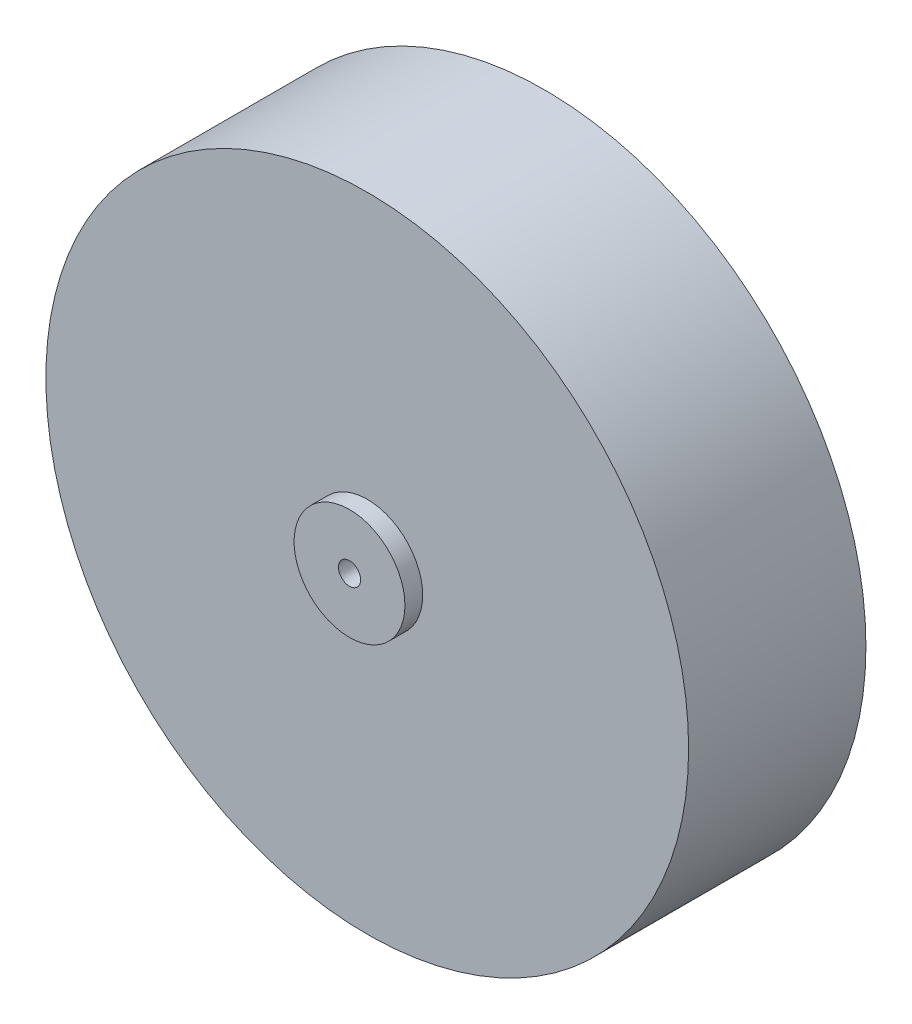
from build123d import *

# Parameters (mm, degrees)
SKETCH1_R           = 72.5
BOSS_EXTRUDE1_DEPTH = 20
SKETCH2_R           = 12.5
BOSS_EXTRUDE2_DEPTH = 4
KEYWAY_DEPTH        = 119.349858818


with BuildPart() as part:
    # Sketch1 → Boss-Extrude1 (new, symmetric)
    with BuildSketch(Plane.XY):
        Circle(SKETCH1_R)
    extrude(amount=BOSS_EXTRUDE1_DEPTH, both=True)

    # Sketch2 → Boss-Extrude2 (add)
    with BuildSketch(Plane.XY.offset(20)):
        Circle(SKETCH2_R)
    boss_extrude2 = extrude(amount=BOSS_EXTRUDE2_DEPTH)

    # Mirror1: Boss-Extrude2 across plane
    add(boss_extrude2.mirror(Plane.XY))

    # KeySketch → Keyway (cut, through all)
    with BuildSketch(Plane(origin=(6.62471706, 1.269697251, 24), x_dir=(1, 0, 0), z_dir=(0, 0, 1))):
        with BuildLine():
            ThreePointArc((-7.62471706, 1.021590597), (-6.62471706, -3.769697251), (-5.62471706, 1.021590597))
            ThreePointArc((-5.62471706, 1.021590597), (-6.62471706, 1.230302749), (-7.62471706, 1.021590597))
        make_face()
    extrude(amount=-KEYWAY_DEPTH, mode=Mode.SUBTRACT)


solid = part.part
